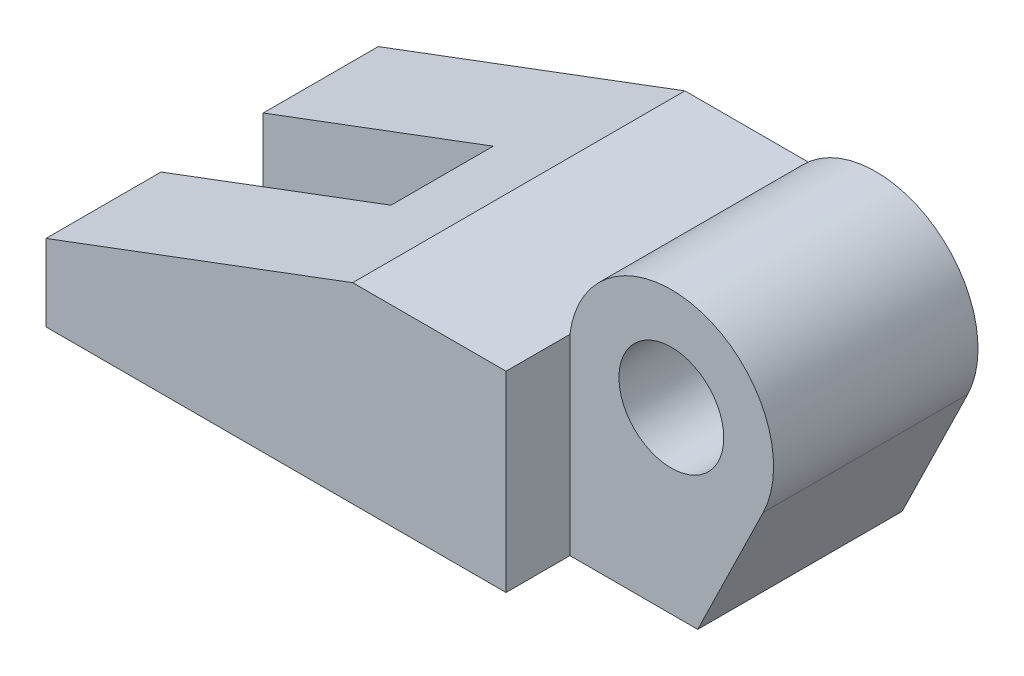
from build123d import *

# Parameters (mm, degrees)
BOSS_EXTRUDE2_DEPTH      = 13
BOSS_EXTRUDE2_DEPTH_BACK = 13
SKETCH3_W                = 18
SKETCH3_H                = 8
CUT_EXTRUDE2_DEPTH       = 27.795522014
BOSS_EXTRUDE3_DEPTH      = 8
BOSS_EXTRUDE3_DEPTH_BACK = 8
SKETCH5_R                = 4.1
CUT_EXTRUDE3_DEPTH       = 43.46159682


with BuildPart() as part:
    # Sketch1 → Boss-Extrude2 (new, two sides: drawn at the far end of the back side and taken through both)
    with BuildSketch(Plane.XY.offset(-BOSS_EXTRUDE2_DEPTH_BACK)):
        Polygon((-18, -1.5), (6, 7.5), (18, 7.5), (18, -7.5), (-18, -7.5), align=None)
    extrude(amount=BOSS_EXTRUDE2_DEPTH + BOSS_EXTRUDE2_DEPTH_BACK)

    # Sketch3 → Cut-Extrude2 (cut, through all)
    with BuildSketch(Plane.XZ.offset(7.5)):
        with Locations((-9, 0)):
            Rectangle(SKETCH3_W, SKETCH3_H)
    extrude(amount=-CUT_EXTRUDE2_DEPTH, mode=Mode.SUBTRACT)

    # Sketch4 → Boss-Extrude3 (add, two sides: drawn at the far end of the back side and taken through both)
    with BuildSketch(Plane.XY.offset(-BOSS_EXTRUDE3_DEPTH_BACK)):
        with BuildLine():
            Line((18, 7.5), (18, -7.5))
            Line((18, -7.5), (28, -7.5))
            Line((28, -7.5), (33.12495505, 2.987600158))
            ThreePointArc((33.12495505, 2.987600158), (28.224369024, 14.166101001), (18, 7.5))
        make_face()
    extrude(amount=BOSS_EXTRUDE3_DEPTH + BOSS_EXTRUDE3_DEPTH_BACK)

    # Sketch5 → Cut-Extrude3 (cut, through all)
    with BuildSketch(Plane.XY.offset(8)):
        with Locations((25.937253933, 6.5)):
            Circle(SKETCH5_R)
    extrude(amount=-CUT_EXTRUDE3_DEPTH, mode=Mode.SUBTRACT)


solid = part.part
